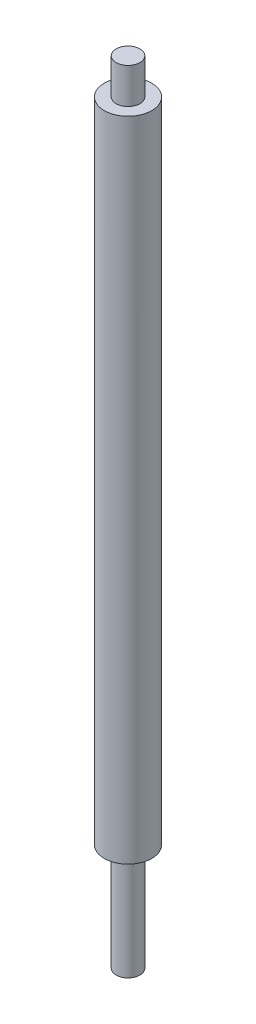
from build123d import *

# Parameters (mm, degrees)
SKETCH1_R           = 6.35
BOSS_EXTRUDE1_DEPTH = 211.1375
CUT_EXTRUDE1_START  = -9.525
SKETCH2_R           = 6.35
SKETCH2_R_2         = 3.175
CUT_EXTRUDE1_DEPTH  = 9.525
SKETCH3_R           = 6.35
SKETCH3_R_2         = 3.175
CUT_EXTRUDE2_DEPTH  = 28.575


with BuildPart() as part:
    # Sketch1 → Boss-Extrude1 (new body)
    with BuildSketch(Plane(origin=(0, 0, 0), x_dir=(1, 0, 0), z_dir=(0, 1, 0))):
        with Locations(Location((0, 0, 0), (0, 0, 270))):
            Circle(SKETCH1_R)
    extrude(amount=BOSS_EXTRUDE1_DEPTH)

    # Sketch2 → Cut-Extrude1 (cut)
    with BuildSketch(Plane(origin=(0, 211.1375, 0), x_dir=(1, 0, 0), z_dir=(0, 1, 0)).offset(CUT_EXTRUDE1_START)):
        with Locations(Location((0, 0, 0), (0, 0, 270))):
            Circle(SKETCH2_R)
        with Locations(Location((0, 0, 0), (0, 0, 270))):
            Circle(SKETCH2_R_2, mode=Mode.SUBTRACT)
    extrude(amount=CUT_EXTRUDE1_DEPTH, mode=Mode.SUBTRACT)

    # Sketch3 → Cut-Extrude2 (cut)
    with BuildSketch(Plane.XZ):
        with Locations(Location((0, 0, 0), (0, 0, 270))):
            Circle(SKETCH3_R)
        with Locations(Location((0, 0, 0), (0, 0, 90))):
            Circle(SKETCH3_R_2, mode=Mode.SUBTRACT)
    extrude(amount=-CUT_EXTRUDE2_DEPTH, mode=Mode.SUBTRACT)


solid = part.part
